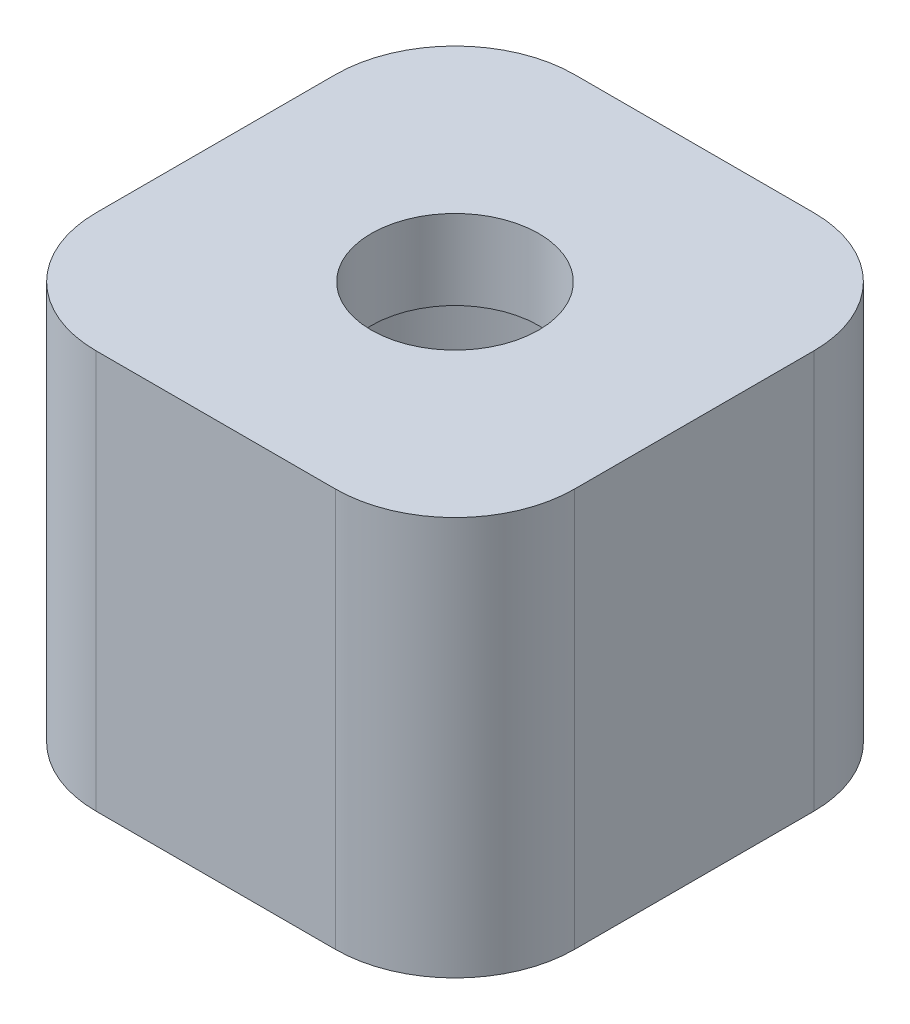
from build123d import *

# Parameters (mm, degrees)
SKETCH1_R           = 2.1
BOSS_EXTRUDE1_DEPTH = 10
SKETCH2_R           = 4.4
CUT_EXTRUDE1_DEPTH  = 8


with BuildPart() as part:
    # Sketch1 → Boss-Extrude1 (new body)
    with BuildSketch(Plane(origin=(0, 0, 0), x_dir=(1, 0, 0), z_dir=(0, 1, 0))):
        with BuildLine():
            Line((-3, -6), (3, -6))
            ThreePointArc((3, -6), (5.121320344, -5.121320344), (6, -3))
            Line((6, -3), (6, 3))
            ThreePointArc((6, 3), (5.121320344, 5.121320344), (3, 6))
            Line((3, 6), (-3, 6))
            ThreePointArc((-3, 6), (-5.121320344, 5.121320344), (-6, 3))
            Line((-6, 3), (-6, -3))
            ThreePointArc((-6, -3), (-5.121320344, -5.121320344), (-3, -6))
        make_face()
        with Locations(Location((0, 0, 0), (0, 0, 270))):
            Circle(SKETCH1_R, mode=Mode.SUBTRACT)
    extrude(amount=BOSS_EXTRUDE1_DEPTH)

    # Sketch2 → Cut-Extrude1 (cut)
    with BuildSketch(Plane.XZ):
        with Locations(Location((0, 0, 0), (0, 0, 270))):
            Circle(SKETCH2_R)
    extrude(amount=-CUT_EXTRUDE1_DEPTH, mode=Mode.SUBTRACT)


solid = part.part
